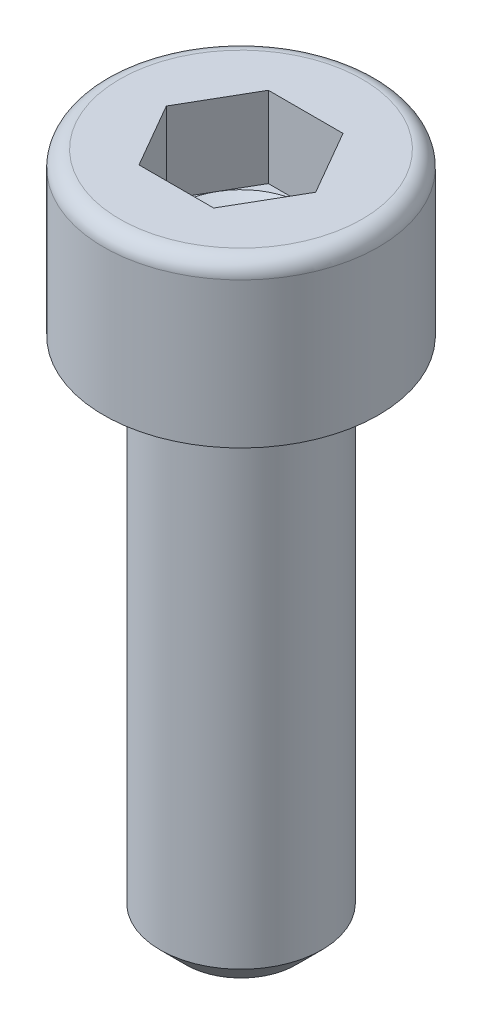
from build123d import *

# Parameters (mm, degrees)
TIGE_START              = -16
ESQUISSE1_R             = 2.5
TIGE_DEPTH              = 16
CHANFREIN_D_ENTR_E_SIZE = 0.8
HEXAGONE_DEPTH          = 2.5


with BuildPart() as part:
    # Esquisse1 → Tige (new body)
    with BuildSketch(Plane(origin=(0, 0, 0), x_dir=(1, 0, 0), z_dir=(0, 1, 0)).offset(TIGE_START)):
        with Locations(Location((0, 0, 0), (0, 0, 270))):
            Circle(ESQUISSE1_R)
    extrude(amount=TIGE_DEPTH)

    # Chanfrein d'entrée
    chanfrein_d_entr_e_edges = [part.edges().sort_by_distance(p)[0] for p in [
        (0, -16, -2.5),
    ]]
    chamfer(chanfrein_d_entr_e_edges, length=CHANFREIN_D_ENTR_E_SIZE)

    # Esquisse2 → Tête (revolve)
    with BuildSketch(Plane.XY, mode=Mode.PRIVATE) as t_te_sk:
        with BuildLine():
            Line((2, 5), (2, 2.5))
            Line((2, 2.5), (0, 1.345299462))
            Line((0, 1.345299462), (0, 0))
            Line((0, 0), (4.25, 0))
            Line((4.25, 0), (4.25, 4.5))
            ThreePointArc((4.25, 4.5), (4.103553391, 4.853553391), (3.75, 5))
            Line((3.75, 5), (2, 5))
        make_face()
    revolve(t_te_sk.sketch.rotate(Axis((0, 5, 0), (0, -1, 0)), 180), axis=Axis((0, 5, 0), (0, -1, 0)))

    # Esquisse3 → Hexagone (cut)
    with BuildSketch(Plane(origin=(0, 5, -3), x_dir=(1, 0, 0), z_dir=(0, -1, 0))):
        Polygon((1.154700538, 5), (-1.154700538, 5), (-2.309401077, 3), (-1.154700538, 1), (1.154700538, 1), (2.309401077, 3), align=None)
    extrude(amount=HEXAGONE_DEPTH, mode=Mode.SUBTRACT)


solid = part.part
